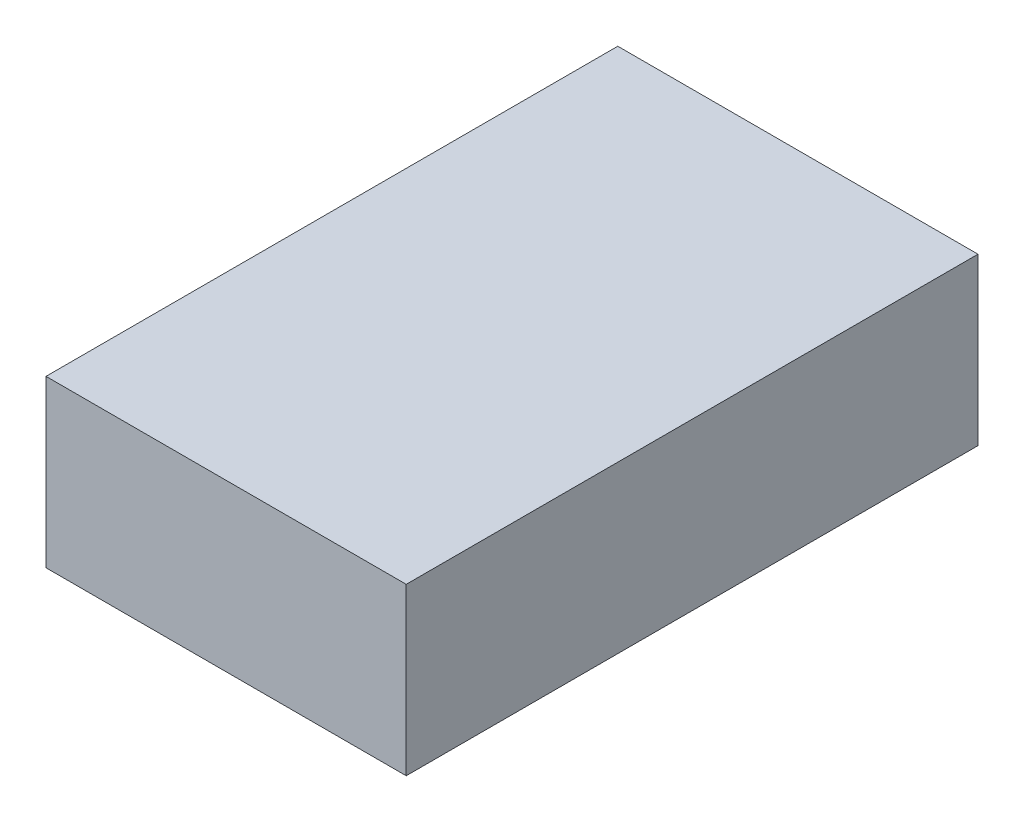
from build123d import *

# Parameters (mm, degrees)
IZIM1_W                     = 31.5
IZIM1_H                     = 14.5
Y_KSEKLIK_EKSTR_ZYON1_DEPTH = 50


with BuildPart() as part:
    # Çizim1 → Yükseklik-Ekstrüzyon1 (new body)
    with BuildSketch(Plane.XY):
        with Locations((2.362810406, 1.292372881)):
            Rectangle(IZIM1_W, IZIM1_H)
    extrude(amount=Y_KSEKLIK_EKSTR_ZYON1_DEPTH)


solid = part.part
